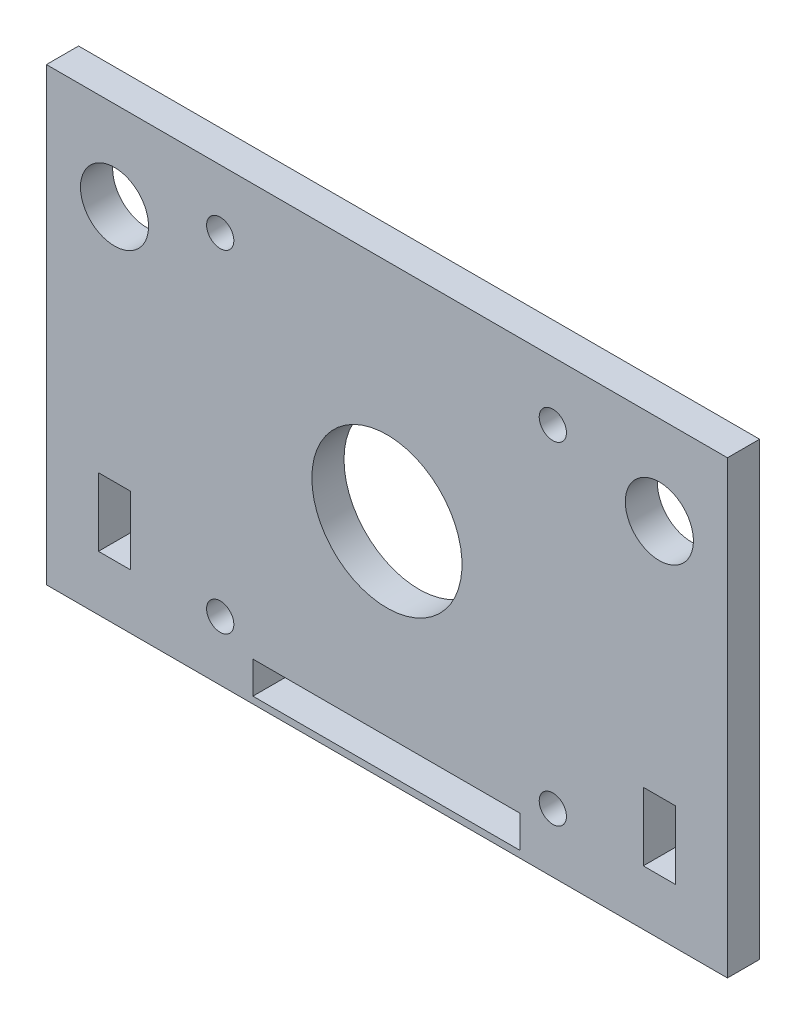
from build123d import *

# Parameters (mm, degrees)
SKETCH1_W           = 63.5
SKETCH1_H           = 42.01
SKETCH1_R           = 1.27
SKETCH1_R_2         = 3.175
SKETCH1_R_3         = 7
SKETCH1_W_2         = 24.9174
SKETCH1_H_2         = 2.9972
SKETCH1_W_3         = 2.9972
SKETCH1_H_3         = 6.35
BOSS_EXTRUDE1_DEPTH = 2.9972


with BuildPart() as part:
    # Sketch1 → Boss-Extrude1 (new body)
    with BuildSketch(Plane.XY):
        Rectangle(SKETCH1_W, SKETCH1_H)
        with Locations(Location((-15.5448, -15.4678, 0), (0, 0, 180))):
            Circle(SKETCH1_R, mode=Mode.SUBTRACT)
        with Locations(Location((15.4686, -15.4678, 0), (0, 0, 180))):
            Circle(SKETCH1_R, mode=Mode.SUBTRACT)
        with Locations(Location((15.4686, 15.5186, 0), (0, 0, 180))):
            Circle(SKETCH1_R, mode=Mode.SUBTRACT)
        with Locations(Location((-15.5448, 15.5186, 0), (0, 0, 180))):
            Circle(SKETCH1_R, mode=Mode.SUBTRACT)
        with Locations(Location((25.4, 12.7, 0), (0, 0, 180))):
            Circle(SKETCH1_R_2, mode=Mode.SUBTRACT)
        with Locations(Location((0, 0, 0), (0, 0, 180))):
            Circle(SKETCH1_R_3, mode=Mode.SUBTRACT)
        with Locations(Location((-25.4, 12.7, 0), (0, 0, 180))):
            Circle(SKETCH1_R_2, mode=Mode.SUBTRACT)
        with Locations((-0.0381, -18.8714)):
            Rectangle(SKETCH1_W_2, SKETCH1_H_2, mode=Mode.SUBTRACT)
        with Locations((-25.4, -12.7)):
            Rectangle(SKETCH1_W_3, SKETCH1_H_3, mode=Mode.SUBTRACT)
        with Locations((25.4, -12.7)):
            Rectangle(SKETCH1_W_3, SKETCH1_H_3, mode=Mode.SUBTRACT)
    extrude(amount=BOSS_EXTRUDE1_DEPTH)


solid = part.part
